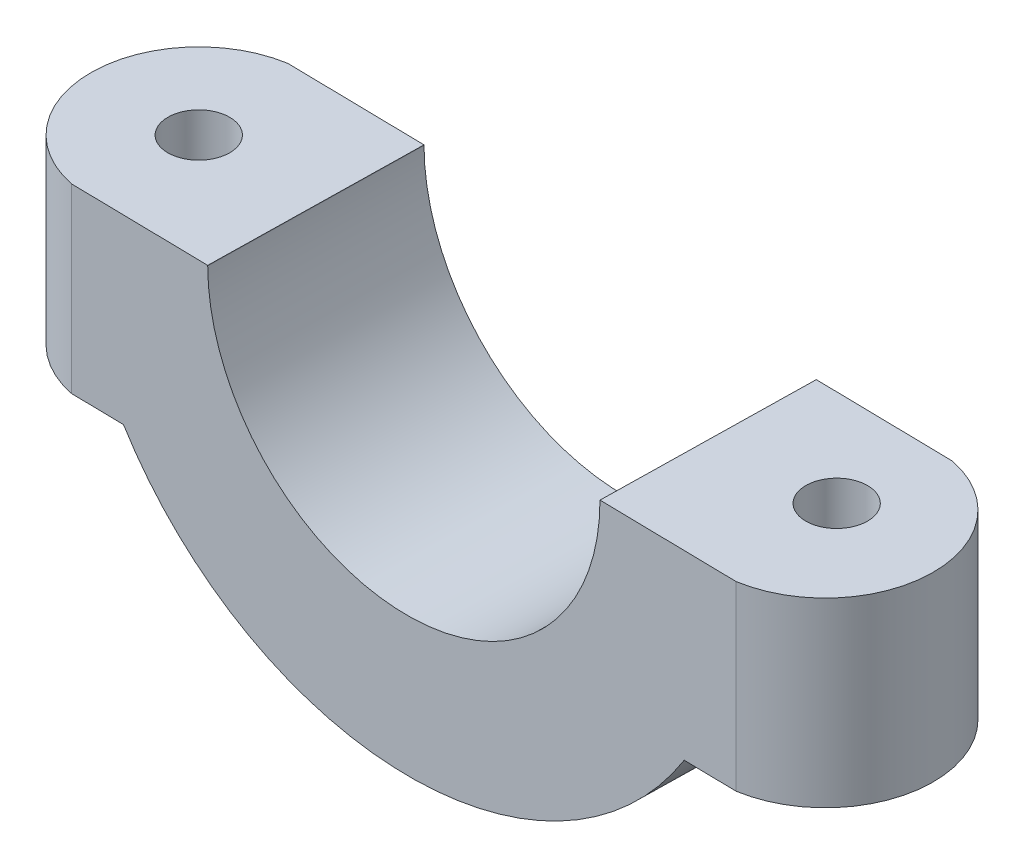
from build123d import *

# Parameters (mm, degrees)
EXTRUDE_1_DEPTH     = 10
EXTRUDE_1_2_DEPTH   = 10
EXTRUDE_3_DEPTH     = 11.703576761
SKETCH_5_R          = 1.7
CUT_EXTRUDE_1_DEPTH = 27.289015437
CUT_EXTRUDE_2_DEPTH = 2.4


with BuildPart() as part:
    # 草图1 → 凸台-拉伸1 (new body)
    with BuildSketch(Plane(origin=(0, 0, 0), x_dir=(1, 0, 0), z_dir=(0, 1, 0))):
        with BuildLine():
            Line((10.893392623, -6.049715663), (18.526323659, -6.186490707))
            ThreePointArc((18.526323659, -6.186490707), (23.511587835, -0.423094228), (18.736007239, 5.515207537))
            Line((18.736007239, 5.515207537), (11.103076203, 5.651982581))
            Line((11.103076203, 5.651982581), (10.893392623, -6.049715663))
        make_face()
    extrude(amount=EXTRUDE_1_DEPTH)



with BuildPart() as body_2:
    # 草图1 → Extrude 1 2 (new body)
    with BuildSketch(Plane(origin=(0, 0, 0), x_dir=(1, 0, 0), z_dir=(0, 1, 0))):
        with BuildLine():
            Line((-10.893392623, 6.046138902), (-18.526323659, 6.182913947))
            ThreePointArc((-18.526323659, 6.182913947), (-23.511587835, 0.419517467), (-18.736007239, -5.518784297))
            Line((-18.736007239, -5.518784297), (-11.103076203, -5.655559342))
            Line((-11.103076203, -5.655559342), (-10.893392623, 6.046138902))
        make_face()
    extrude(amount=EXTRUDE_1_2_DEPTH)


with BuildPart() as part_1:
    add(part.part)

    add(body_2.part)  # 凸台-拉伸3 merges body 2
    # 草图3 → 凸台-拉伸3 (add)
    with BuildSketch(Plane(origin=(-0.104873826, 0, 5.852636928), x_dir=(0.9998394920722602, 0, 0.017916196378829744), z_dir=(-0.017916196378829744, 0, 0.9998394920722602))):
        with BuildLine():
            Line((-11, 10), (-18.634156379, 10))
            ThreePointArc((-18.634156379, 10), (0, -8.634156379), (18.634156379, 10))
            Line((18.634156379, 10), (11, 10))
            ThreePointArc((11, 10), (0, -1), (-11, 10))
        make_face()
    extrude(amount=-EXTRUDE_3_DEPTH)

    # 草图5 → 切除-拉伸1 (cut, through all)
    with BuildSketch(Plane.XZ):
        with Locations(Location((-17.564258534, -0.312946842, 0), (0, 0, 270))):
            Circle(SKETCH_5_R)
        with Locations(Location((17.564258534, -0.312946842, 0), (0, 0, 90))):
            Circle(SKETCH_5_R)
    extrude(amount=-CUT_EXTRUDE_1_DEPTH, mode=Mode.SUBTRACT)

    # 草图6 → 切除-拉伸2 (cut, symmetric)
    with BuildSketch(Plane.XZ):
        Polygon((20.314258534, -1.900660082), (17.564258534, -3.488373323), (14.814258534, -1.900660082), (14.814258534, 1.274766398), (17.564258534, 2.862479638), (20.314258534, 1.274766398), align=None)
        Polygon((-17.564258534, -3.488373323), (-14.814258534, -1.900660082), (-14.814258534, 1.274766398), (-17.564258534, 2.862479638), (-20.314258534, 1.274766398), (-20.314258534, -1.900660082), align=None)
    extrude(amount=CUT_EXTRUDE_2_DEPTH, both=True, mode=Mode.SUBTRACT)


solid = part_1.part
